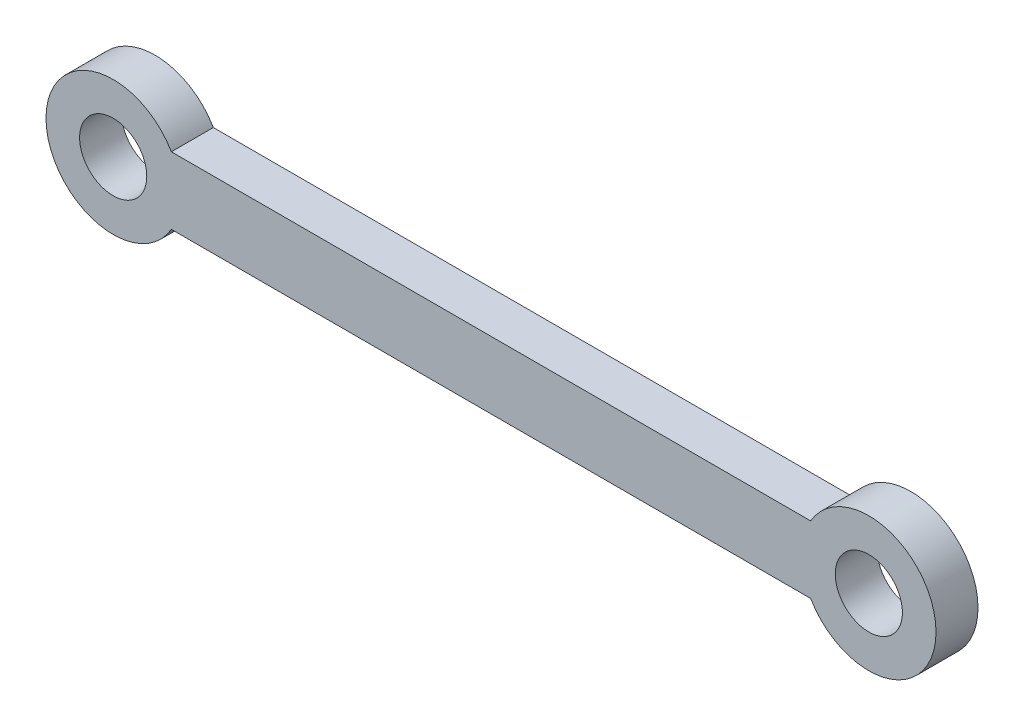
from build123d import *

# Parameters (mm, degrees)
BOSS_EXTRUDE1_DEPTH = 3.175
SKETCH2_R           = 2.54
CUT_EXTRUDE1_DEPTH  = 63.775137794


with BuildPart() as part:
    # Sketch1 → Boss-Extrude1 (new body)
    with BuildSketch(Plane.XY):
        with BuildLine():
            Line((0, 5.08), (0, 0))
            Line((0, 0), (4.399409051, 0))
            ThreePointArc((4.399409051, 0), (4.906903198, 1.225199251), (5.08, 2.54))
            ThreePointArc((5.08, 2.54), (4.906903198, 3.854800749), (4.399409051, 5.08))
            Line((4.399409051, 5.08), (0, 5.08))
        make_face()
        with BuildLine():
            Line((4.399409051, 0), (0, 0))
            Line((0, 0), (0, 5.08))
            Line((0, 5.08), (4.399409051, 5.08))
            ThreePointArc((4.399409051, 5.08), (-5.08, 2.54), (4.399409051, 0))
        make_face()
        with BuildLine():
            ThreePointArc((5.08, 2.54), (4.906903198, 1.225199251), (4.399409051, 0))
            Line((4.399409051, 0), (52.750590949, 0))
            ThreePointArc((52.750590949, 0), (52.07, 2.54), (52.750590949, 5.08))
            Line((52.750590949, 5.08), (4.399409051, 5.08))
            ThreePointArc((4.399409051, 5.08), (4.906903198, 3.854800749), (5.08, 2.54))
        make_face()
        with BuildLine():
            ThreePointArc((52.750590949, 5.08), (52.07, 2.54), (52.750590949, 0))
            Line((52.750590949, 0), (57.15, 0))
            Line((57.15, 0), (57.15, 5.08))
            Line((57.15, 5.08), (52.750590949, 5.08))
        make_face()
        with BuildLine():
            Line((57.15, 0), (52.750590949, 0))
            ThreePointArc((52.750590949, 0), (58.464800749, -2.366903198), (62.23, 2.54))
            ThreePointArc((62.23, 2.54), (58.464800749, 7.446903198), (52.750590949, 5.08))
            Line((52.750590949, 5.08), (57.15, 5.08))
            Line((57.15, 5.08), (57.15, 0))
        make_face()
    extrude(amount=BOSS_EXTRUDE1_DEPTH)

    # Sketch2 → Cut-Extrude1 (cut, through all)
    with BuildSketch(Plane.XY.offset(3.175)):
        with Locations((0, 2.54)):
            Circle(SKETCH2_R)
        with Locations((57.15, 2.54)):
            Circle(SKETCH2_R)
    extrude(amount=-CUT_EXTRUDE1_DEPTH, mode=Mode.SUBTRACT)


solid = part.part
